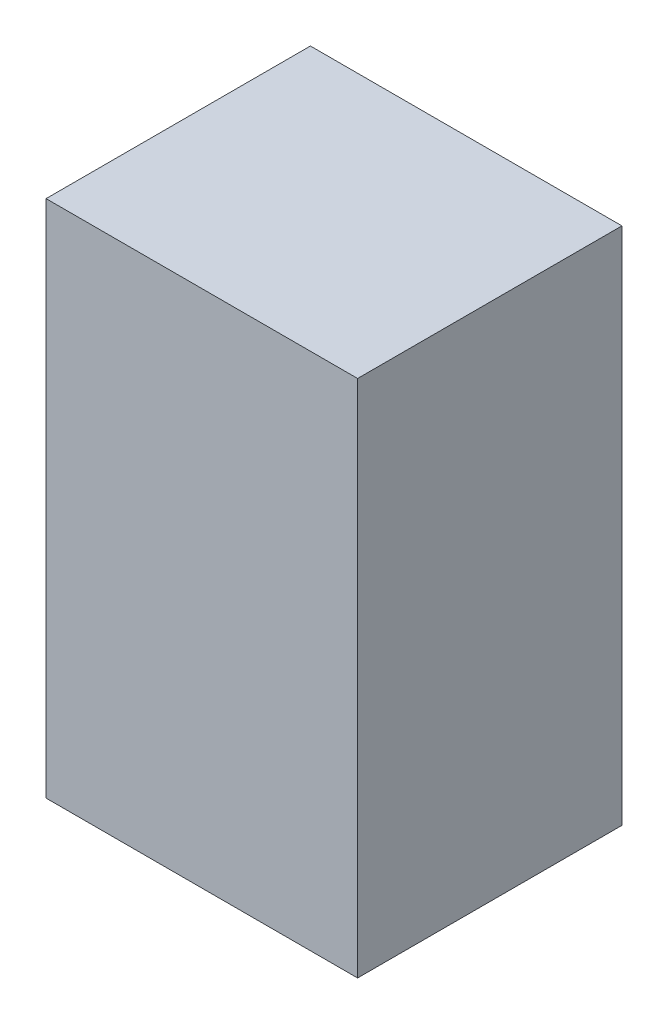
from build123d import *

# Parameters (mm, degrees)
SKETCH1_W           = 838.2
SKETCH1_H           = 711.2
BOSS_EXTRUDE1_DEPTH = 1397


with BuildPart() as part:
    # Sketch1 → Boss-Extrude1 (new body)
    with BuildSketch(Plane(origin=(0, 0, 0), x_dir=(1, 0, 0), z_dir=(0, 1, 0))):
        with Locations((419.1, 355.6)):
            Rectangle(SKETCH1_W, SKETCH1_H)
    extrude(amount=BOSS_EXTRUDE1_DEPTH)


solid = part.part
